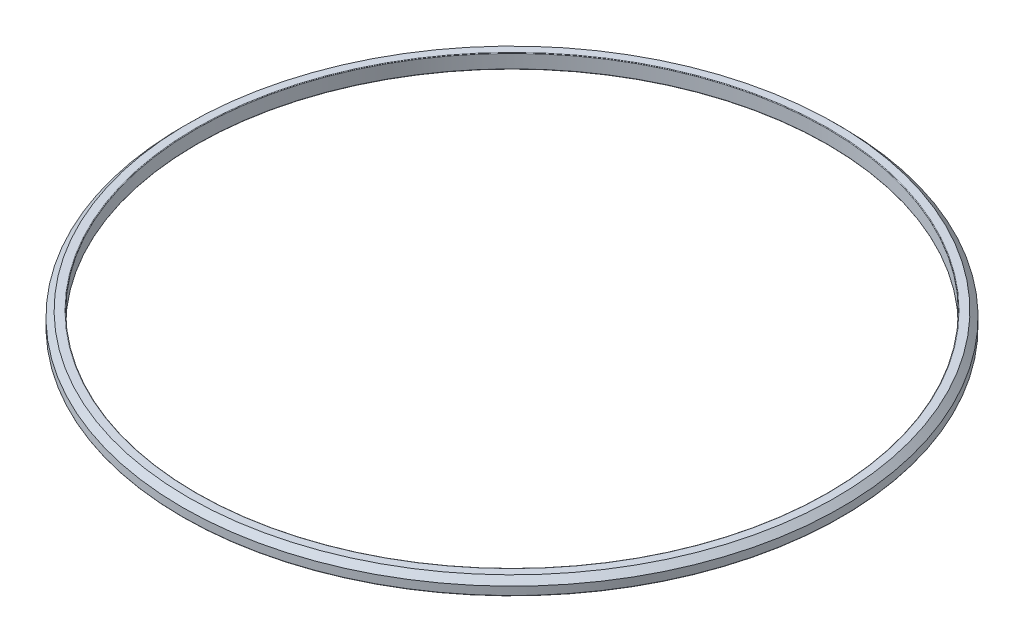
from build123d import *

# Parameters (mm, degrees)
SKETCH1_R           = 57.2125
SKETCH1_R_2         = 54.7875
BOSS_EXTRUDE1_DEPTH = 2.5
CHAMFER1_SIZE       = 1
FILLET1_R           = 0.1


with BuildPart() as part:
    # Sketch1 → Boss-Extrude1 (new body)
    with BuildSketch(Plane(origin=(0, 0, 0), x_dir=(1, 0, 0), z_dir=(0, 1, 0))):
        with Locations(Location((0, 0, 0), (0, 0, 270))):
            Circle(SKETCH1_R)
        with Locations(Location((0, 0, 0), (0, 0, 270))):
            Circle(SKETCH1_R_2, mode=Mode.SUBTRACT)
    extrude(amount=BOSS_EXTRUDE1_DEPTH)

    # Chamfer1
    chamfer1_edges = [part.edges().sort_by_distance(p)[0] for p in [
        (0, 2.5, -57.2125),
    ]]
    chamfer(chamfer1_edges, length=CHAMFER1_SIZE)

    # Fillet1
    fillet1_edges = [part.edges().sort_by_distance(p)[0] for p in [
        (0, 0, -57.2125),
        (0, 0, -54.7875),
        (0, 2.5, -54.7875),
    ]]
    fillet(fillet1_edges, radius=FILLET1_R)


solid = part.part
